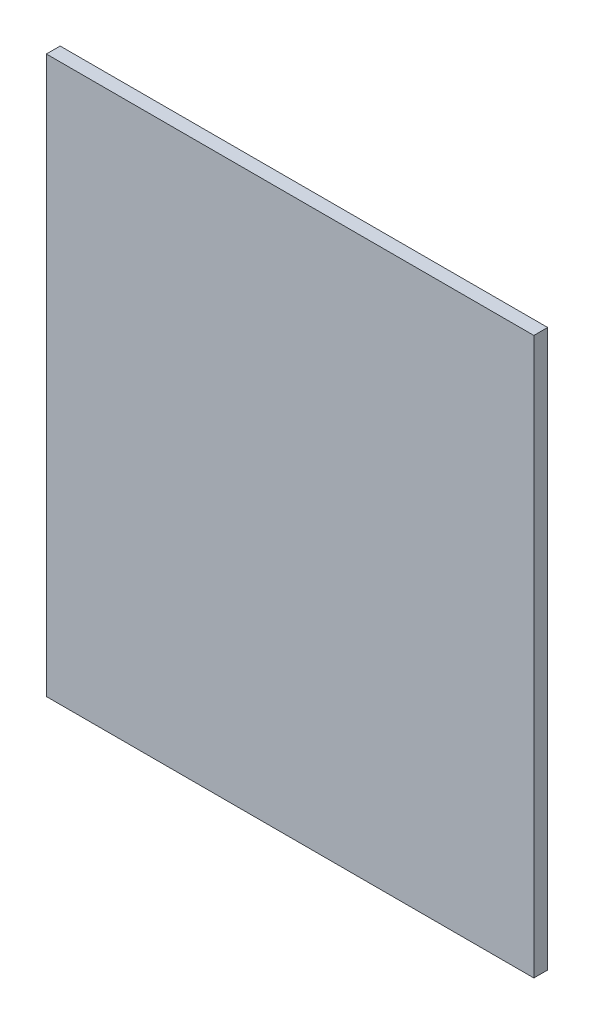
from build123d import *

# Parameters (mm, degrees)
SKETCH_1_W         = 106
SKETCH_1_H         = 121
BLOCKEXTRUDE_DEPTH = 3


with BuildPart() as part:
    # 草图1 → BlockExtrude (new body)
    with BuildSketch(Plane.XY):
        with Locations((53, 60.5)):
            Rectangle(SKETCH_1_W, SKETCH_1_H)
    extrude(amount=BLOCKEXTRUDE_DEPTH)


solid = part.part
